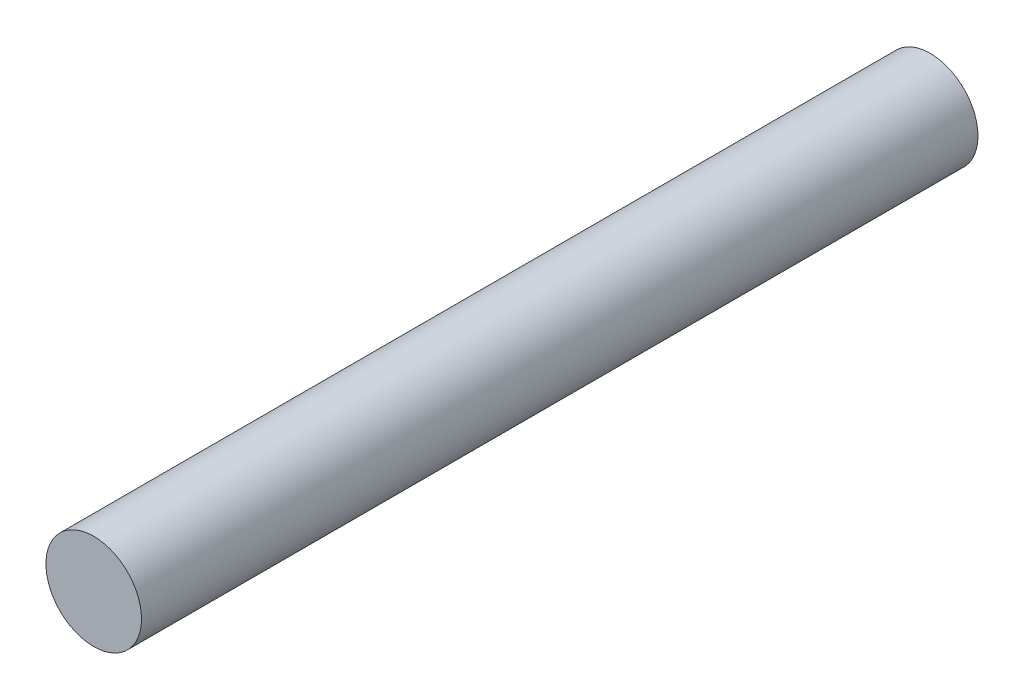
from build123d import *

# Parameters (mm, degrees)
SKETCH1_R           = 0.4
BOSS_EXTRUDE1_DEPTH = 7


with BuildPart() as part:
    # Sketch1 → Boss-Extrude1 (new body)
    with BuildSketch(Plane.XY):
        Circle(SKETCH1_R)
    extrude(amount=BOSS_EXTRUDE1_DEPTH)


solid = part.part
